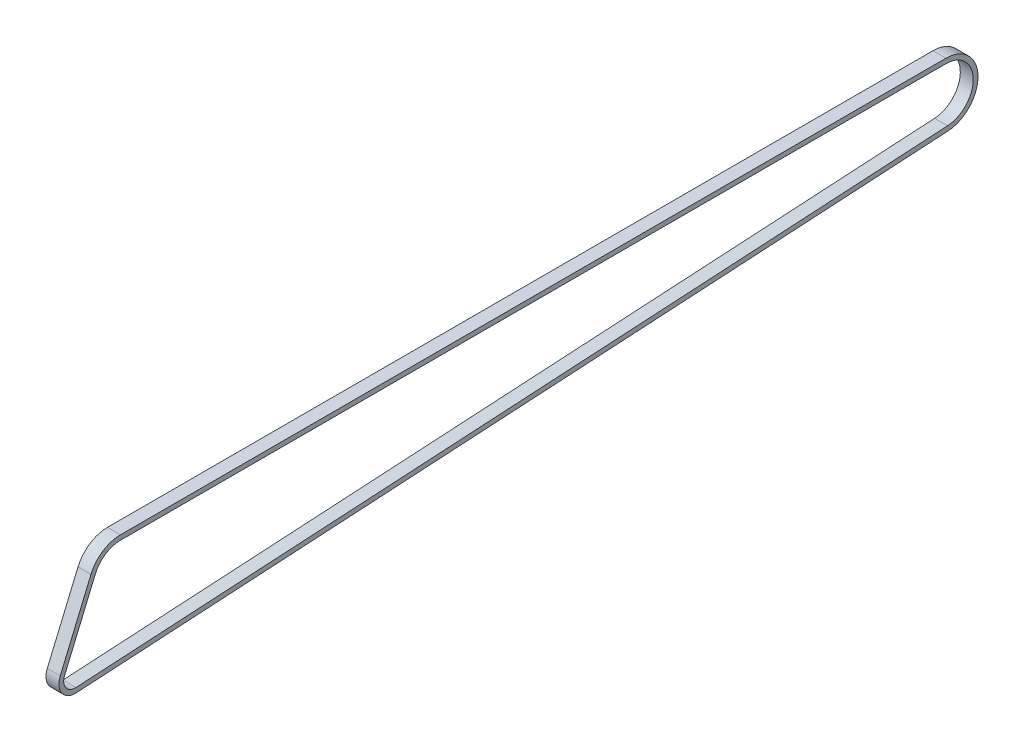
from build123d import *

# Parameters (mm, degrees)
SKETCH3_W = 6
SKETCH3_H = 2.2


with BuildPart() as part:
    # Sweep1: sweep along a path in Sketch1
    with BuildLine(Plane(origin=(0, 0, 0), x_dir=(0, 0, -1), z_dir=(1, 0, 0))) as sweep1_path:
        Line((0.31090006, -5.3474047), (403.879965212, 18.116247973))
        ThreePointArc((403.879965212, 18.116247973), (415.790396806, 31.112194288), (403.14572952, 43.394921614))
        Line((403.14572952, 43.394921614), (20.942535542, 43.394921614))
        ThreePointArc((20.942535542, 43.394921614), (13.956361094, 41.290814966), (9.294242947, 35.678457834))
        Line((9.294242947, 35.678457834), (-4.932278427, 2.089024985))
        ThreePointArc((-4.932278427, 2.089024985), (-4.377716999, -3.086582212), (0.31090006, -5.3474047))
    # Sketch3 → Sweep1 (sweep)
    with BuildSketch(Plane(origin=(0, 2.089024985, 4.932278427), x_dir=(1, 0, 0), z_dir=(0, -0.9208136438300306, 0.39000286324136324))):
        with Locations((0, 1.1)):
            Rectangle(SKETCH3_W, SKETCH3_H)
    sweep(path=sweep1_path.line)


solid = part.part
